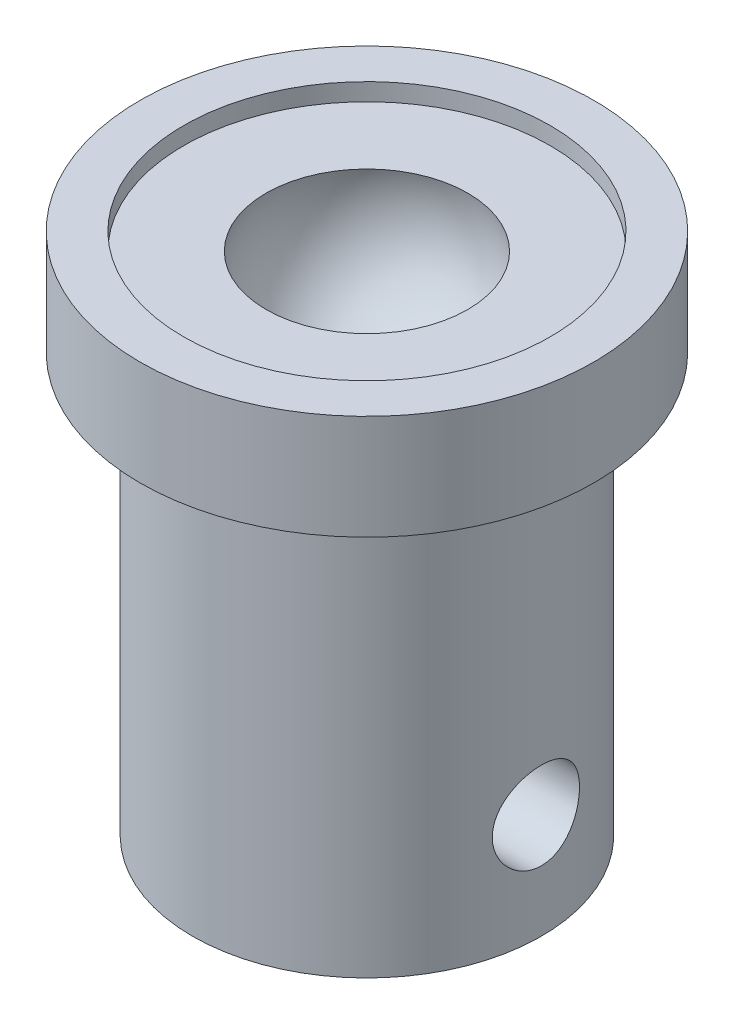
from build123d import *

# Parameters (mm, degrees)
SKETCH_1_R               = 10
EXTRUDE_1_DEPTH          = 30
SKETCH_2_R               = 13
EXTRUDE_2_DEPTH          = 6
CUT_EXTRUDE_1_DEPTH      = 36.185224172
CUT_EXTRUDE_1_DEPTH_BACK = 36.185224172
SKETCH_3_R               = 2.5
SKETCH_4_W               = 9
SKETCH_4_H               = 9
CUT_EXTRUDE_2_DEPTH      = 15
SKETCH_6_R               = 10.5
CUT_EXTRUDE_3_DEPTH      = 1


with BuildPart() as part:
    # 草图1 → 凸台-拉伸1 (new body)
    with BuildSketch(Plane(origin=(0, 0, 0), x_dir=(1, 0, 0), z_dir=(0, 1, 0))):
        with Locations(Location((0, 0, 0), (0, 0, 270))):
            Circle(SKETCH_1_R)
    extrude(amount=EXTRUDE_1_DEPTH)

    # 草图2 → 凸台-拉伸2 (add)
    with BuildSketch(Plane(origin=(0, 30, 0), x_dir=(1, 0, 0), z_dir=(0, 1, 0))):
        with Locations(Location((0, 0, 0), (0, 0, 270))):
            Circle(SKETCH_2_R)
    extrude(amount=-EXTRUDE_2_DEPTH)

    # 草图3 → 切除-拉伸1 (cut, two sides: drawn at the far end of the back side and taken through both)
    with BuildSketch(Plane(origin=(0, 0, 0), x_dir=(0, 0, -1), z_dir=(1, 0, 0)).offset(-CUT_EXTRUDE_1_DEPTH_BACK)):
        with Locations((0, 6)):
            Circle(SKETCH_3_R)
    extrude(amount=CUT_EXTRUDE_1_DEPTH + CUT_EXTRUDE_1_DEPTH_BACK, mode=Mode.SUBTRACT)

    # 草图4 → 切除-拉伸2 (cut)
    with BuildSketch(Plane(origin=(0, 0, 0), x_dir=(-1, 0, 0), z_dir=(0, -1, 0))):
        Rectangle(SKETCH_4_W, SKETCH_4_H)
    extrude(amount=-CUT_EXTRUDE_2_DEPTH, mode=Mode.SUBTRACT)

    # 草图5 → 切除-旋转1 (revolve, cut)
    with BuildSketch(Plane.XY):
        with BuildLine():
            Line((0, 33.394315723), (0, 21.394315723))
            ThreePointArc((0, 21.394315723), (6, 27.394315723), (0, 33.394315723))
        make_face()
    revolve(axis=Axis((0, 37.883813042, 0), (0, -1, 0)), mode=Mode.SUBTRACT)

    # 草图6 → 切除-拉伸3 (cut)
    with BuildSketch(Plane(origin=(0, 30, 0), x_dir=(1, 0, 0), z_dir=(0, 1, 0))):
        with Locations(Location((0, 0, 0), (0, 0, 270))):
            Circle(SKETCH_6_R)
    extrude(amount=-CUT_EXTRUDE_3_DEPTH, mode=Mode.SUBTRACT)


solid = part.part
